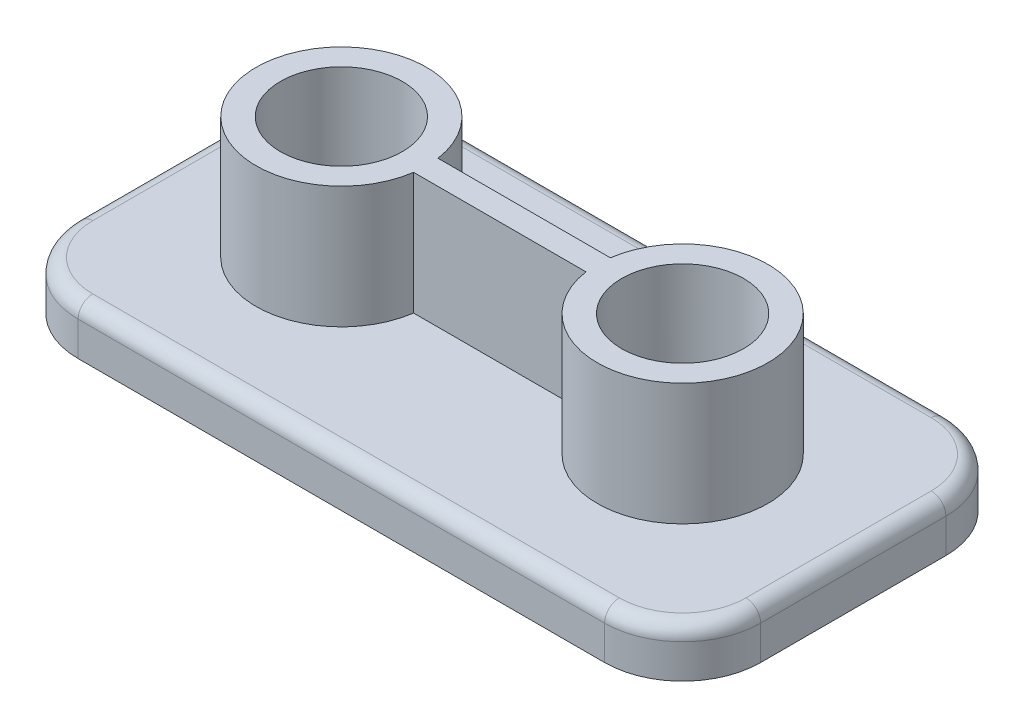
from build123d import *

# Parameters (mm, degrees)
SKETCH1_W           = 140
SKETCH1_H           = 70
BOSS_EXTRUDE1_DEPTH = 10
BOSS_EXTRUDE2_DEPTH = 25
FILLET2_R           = 16
FILLET1_R           = 3


with BuildPart() as part:
    # Sketch1 → Boss-Extrude1 (new body)
    with BuildSketch(Plane(origin=(0, 0, 0), x_dir=(1, 0, 0), z_dir=(0, 1, 0))):
        with Locations((70, 35)):
            Rectangle(SKETCH1_W, SKETCH1_H)
    extrude(amount=BOSS_EXTRUDE1_DEPTH)

    # Sketch2 → Boss-Extrude2 (add)
    with BuildSketch(Plane(origin=(0, 10, 0), x_dir=(1, 0, 0), z_dir=(0, 1, 0))):
        with BuildLine():
            ThreePointArc((52.5, 35), (52.45506934, 36.253217594), (52.320508076, 37.5))
            Line((52.320508076, 37.5), (47.247448714, 37.5))
            ThreePointArc((47.247448714, 37.5), (47.436701913, 36.256362025), (47.5, 35))
            ThreePointArc((47.5, 35), (47.436701913, 33.743637975), (47.247448714, 32.5))
            Line((47.247448714, 32.5), (52.320508076, 32.5))
            ThreePointArc((52.320508076, 32.5), (52.45506934, 33.746782406), (52.5, 35))
        make_face()
        with BuildLine():
            Line((47.247448714, 37.5), (52.320508076, 37.5))
            ThreePointArc((52.320508076, 37.5), (17.5, 35), (52.320508076, 32.5))
            Line((52.320508076, 32.5), (47.247448714, 32.5))
            ThreePointArc((47.247448714, 32.5), (22.5, 35), (47.247448714, 37.5))
        make_face()
        with BuildLine():
            Line((70, 32.5), (70, 37.5))
            Line((70, 37.5), (52.320508076, 37.5))
            ThreePointArc((52.320508076, 37.5), (52.45506934, 36.253217594), (52.5, 35))
            ThreePointArc((52.5, 35), (52.45506934, 33.746782406), (52.320508076, 32.5))
            Line((52.320508076, 32.5), (70, 32.5))
        make_face()
        with BuildLine():
            Line((87.679491924, 37.5), (70, 37.5))
            Line((70, 37.5), (70, 32.5))
            Line((70, 32.5), (87.679491924, 32.5))
            ThreePointArc((87.679491924, 32.5), (87.5, 35), (87.679491924, 37.5))
        make_face()
        with BuildLine():
            ThreePointArc((122.5, 35), (106.253217594, 52.45506934), (87.679491924, 37.5))
            Line((87.679491924, 37.5), (92.752551286, 37.5))
            ThreePointArc((92.752551286, 37.5), (106.256362025, 47.436701913), (117.5, 35))
            ThreePointArc((117.5, 35), (106.256362025, 22.563298087), (92.752551286, 32.5))
            Line((92.752551286, 32.5), (87.679491924, 32.5))
            ThreePointArc((87.679491924, 32.5), (106.253217594, 17.54493066), (122.5, 35))
        make_face()
        with BuildLine():
            Line((92.752551286, 37.5), (87.679491924, 37.5))
            ThreePointArc((87.679491924, 37.5), (87.5, 35), (87.679491924, 32.5))
            Line((87.679491924, 32.5), (92.752551286, 32.5))
            ThreePointArc((92.752551286, 32.5), (92.5, 35), (92.752551286, 37.5))
        make_face()
    extrude(amount=BOSS_EXTRUDE2_DEPTH)

    # Fillet2
    fillet2_edges = [part.edges().sort_by_distance(p)[0] for p in [
        (0, 5, -70),
        (140, 5, -70),
        (140, 5, 0),
        (0, 5, 0),
    ]]
    fillet(fillet2_edges, radius=FILLET2_R)

    # Fillet1
    fillet1_edges = [part.edges().sort_by_distance(p)[0] for p in [
        (0, 10, -35),
        (70, 10, -70),
        (70, 10, 0),
        (140, 10, -35),
        (4.686291501, 10, -4.686291501),
        (135.313708499, 10, -4.686291501),
        (135.313708499, 10, -65.313708499),
        (4.686291501, 10, -65.313708499),
    ]]
    fillet(fillet1_edges, radius=FILLET1_R)


solid = part.part
